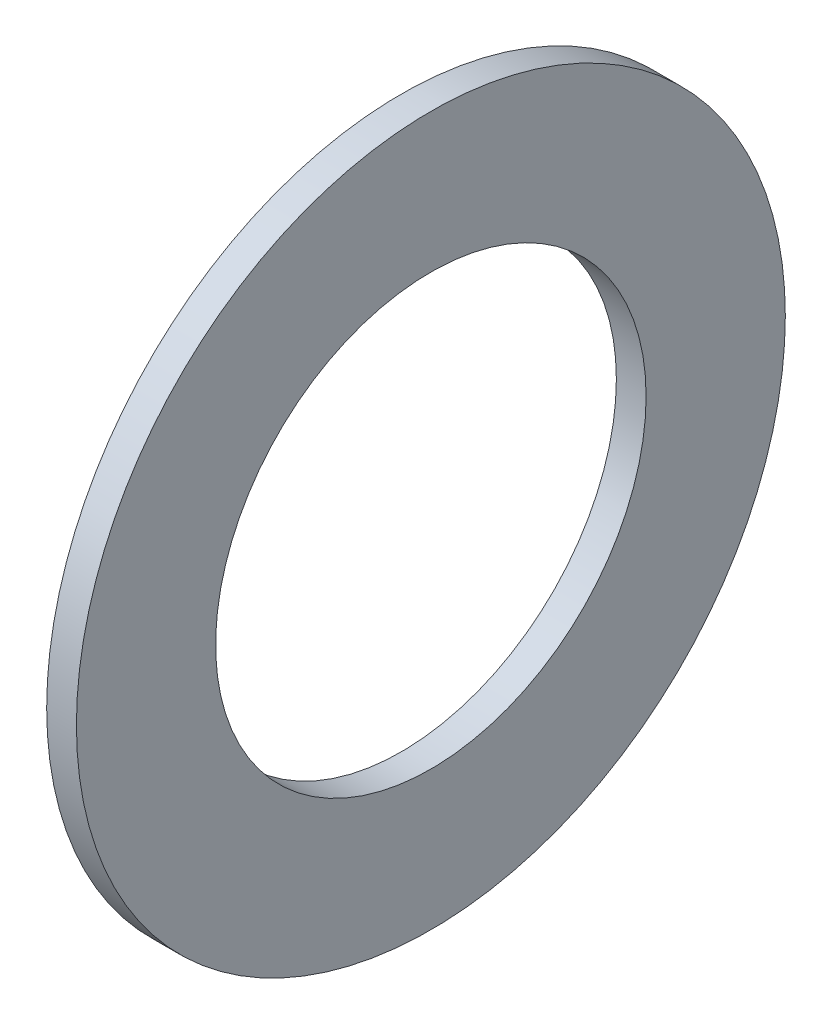
from build123d import *

# Parameters (mm, degrees)
SKETCH1_R           = 47.675
SKETCH1_R_2         = 28.95
BOSS_EXTRUDE1_DEPTH = 4


with BuildPart() as part:
    # Sketch1 → Boss-Extrude1 (new body)
    with BuildSketch(Plane(origin=(0, 0, 0), x_dir=(0, 0, -1), z_dir=(1, 0, 0))):
        Circle(SKETCH1_R)
        Circle(SKETCH1_R_2, mode=Mode.SUBTRACT)
    extrude(amount=BOSS_EXTRUDE1_DEPTH)


solid = part.part
